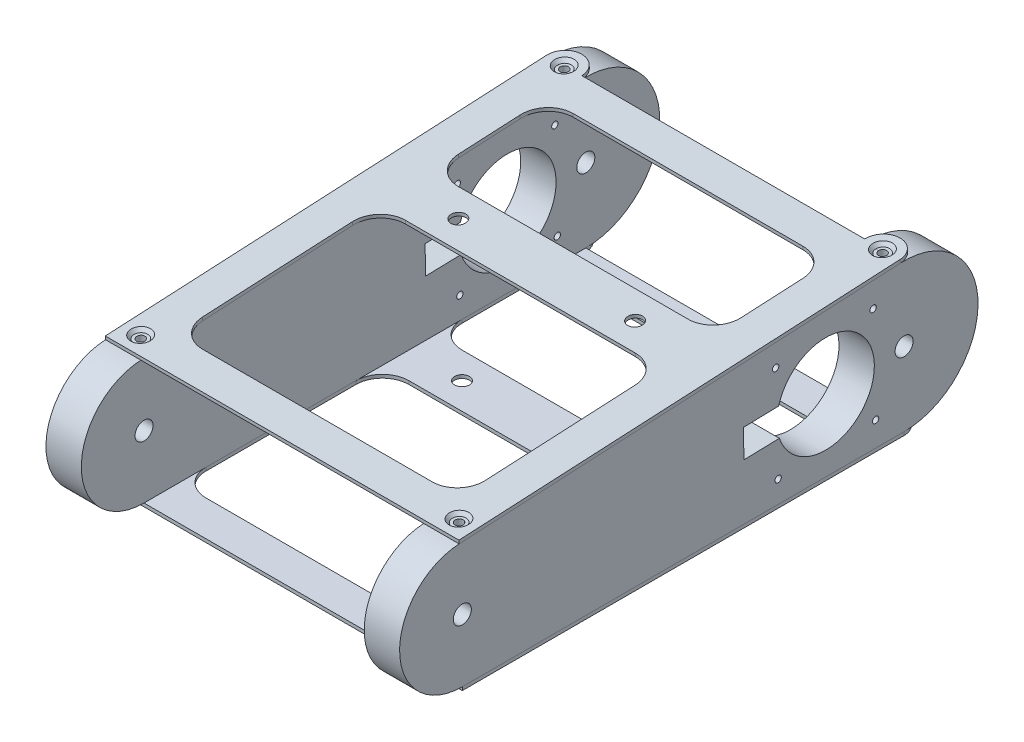
from build123d import *

# Parameters (mm, degrees)
SKETCH1_R                                     = 3.2385
BOSS_EXTRUDE1_DEPTH                           = 12.7
CUT_EXTRUDE1_DEPTH                            = 12.7
SKETCH5_R                                     = 1.143
CUT_EXTRUDE3_DEPTH                            = 12.7
BOSS_EXTRUDE2_DEPTH                           = 1.2
CSK_FOR_6_FLAT_HEAD_MACHINE_SCREW1_AT_2_COUNT = 2
CSK_FOR_6_FLAT_HEAD_MACHINE_SCREW1_AT_2_PITCH = 114.3
CSK_FOR_6_FLAT_HEAD_MACHINE_SCREW1_AT_3_COUNT = 2
CSK_FOR_6_FLAT_HEAD_MACHINE_SCREW1_AT_3_PITCH = 152.297013138
CSK_FOR_6_FLAT_HEAD_MACHINE_SCREW1_AT_4_COUNT = 2
CSK_FOR_6_FLAT_HEAD_MACHINE_SCREW1_AT_4_PITCH = 190.417620536
SKETCH9_R                                     = 2.667
SKETCH9_W                                     = 101.6
SKETCH9_H                                     = 41.275
SKETCH9_H_2                                   = 72.922013138
CUT_EXTRUDE4_DEPTH                            = 1.2
FILLET1_R                                     = 9.525
F_32_0_116_DIAMETER_HOLE1_AT_2_COUNT          = 2
F_32_0_116_DIAMETER_HOLE1_AT_2_PITCH          = 152.297013138
F_32_0_116_DIAMETER_HOLE1_AT_3_COUNT          = 2
F_32_0_116_DIAMETER_HOLE1_AT_3_PITCH          = 190.417620536
F_32_0_116_DIAMETER_HOLE1_AT_4_COUNT          = 2
F_32_0_116_DIAMETER_HOLE1_AT_4_PITCH          = 114.3


with BuildPart() as part:
    # Sketch1 → Boss-Extrude1 (new body)
    with BuildSketch(Plane(origin=(50.8, 0, 0), x_dir=(0, 0, -1), z_dir=(1, 0, 0))):
        with BuildLine():
            Line((-159.793954402, 18.448381084), (-1.35282588, 26.528205981))
            ThreePointArc((-1.35282588, 26.528205981), (26.554058426, 0.676632501), (0, -26.562677773))
            Line((0, -26.562677773), (-158.647013138, -26.562677773))
            ThreePointArc((-158.647013138, -26.562677773), (-181.159847775, -4.616192333), (-159.793954402, 18.448381084))
        make_face()
        with Locations((-158.647013138, -4.042535555)):
            Circle(SKETCH1_R, mode=Mode.SUBTRACT)
        Circle(SKETCH1_R, mode=Mode.SUBTRACT)
    extrude(amount=BOSS_EXTRUDE1_DEPTH)

    # Sketch2 → Cut-Extrude1 (cut)
    with BuildSketch(Plane(origin=(63.5, 0, 0), x_dir=(0, 0, -1), z_dir=(1, 0, 0))):
        with BuildLine():
            Line((-44.780052565, -6.224353351), (-57.480052565, -6.547966135))
            Line((-57.480052565, -6.547966135), (-57.738942792, 3.612033865))
            Line((-57.738942792, 3.612033865), (-45.038942792, 3.935646649))
            ThreePointArc((-45.038942792, 3.935646649), (-10.674659994, -0.272004444), (-44.780052565, -6.224353351))
        make_face()
    extrude(amount=-CUT_EXTRUDE1_DEPTH, mode=Mode.SUBTRACT)

    # Sketch5 → Cut-Extrude3 (cut)
    with BuildSketch(Plane(origin=(63.5, 0, 0), x_dir=(0, 0, -1), z_dir=(1, 0, 0))):
        with Locations((-46.109081348, 16.330760157)):
            Circle(SKETCH5_R)
        with Locations((-11.120438424, 17.222317018)):
            Circle(SKETCH5_R)
        with Locations((-10.228881564, -17.766325906)):
            Circle(SKETCH5_R)
        with Locations((-45.217524487, -18.657882766)):
            Circle(SKETCH5_R)
    extrude(amount=-CUT_EXTRUDE3_DEPTH, mode=Mode.SUBTRACT)


with BuildPart() as body_2:
    # Mirror2: mirrored copy
    add(part.part.mirror(Plane(origin=(0, 0, 0), x_dir=(0, 0, 1), z_dir=(1, 0, 0))))

    # Sketch12 → #32 (0.116) Diameter Hole1 (revolve, cut)
    with BuildSketch(Plane(origin=(-57.15, 26.528205981, 1.35282588), x_dir=(0, -0.05092957463974298, 0.9987022471322545), z_dir=(1, 0, 0))):
        Polygon((0, 0), (0, 13.585187864), (1.4732, 12.7), (1.4732, 0), align=None)
    f_32_0_116_diameter_hole1 = revolve(axis=Axis((-57.15, 32.869965251, 1.676228679), (0, -0.9987022471322546, -0.05092957463974298)), mode=Mode.SUBTRACT)

    # #32 (0.116) Diameter Hole1 at 2: #32 (0.116) Diameter Hole1 ×2
    with Locations(*[Vector(0, -0.050929574639742965, 0.9987022471322545) * (i * F_32_0_116_DIAMETER_HOLE1_AT_2_PITCH) for i in range(1, F_32_0_116_DIAMETER_HOLE1_AT_2_COUNT)]):
        add(f_32_0_116_diameter_hole1, mode=Mode.SUBTRACT)

    # Mirror4: #32 (0.116) Diameter Hole1 across plane
    add(f_32_0_116_diameter_hole1.mirror(Plane(origin=(0, 0, 0), x_dir=(0, -0.025473053092880782, 0.9996755091359031), z_dir=(0, 0.9996755091359032, 0.025473053092880785))), mode=Mode.SUBTRACT)

    # Mirror4 copy 1 sketch → Mirror4 copy 1 (revolve, cut)
    with BuildSketch(Plane(origin=(-57.15, -26.562677773, 152.297013138), x_dir=(0, 0, 1), z_dir=(1, 0, 0))):
        Polygon((0, 0), (0, -13.585187864), (1.4732, -12.7), (1.4732, 0), align=None)
    revolve(axis=Axis((-57.15, -32.912677773, 152.297013138), (0, -1, 0)), mode=Mode.SUBTRACT)


with BuildPart() as body_3:
    # Sketch6 → Boss-Extrude2 (new body)
    with BuildSketch(Plane(origin=(0, 26.528205981, 1.35282588), x_dir=(1, 0, 0), z_dir=(0, 0.9987022471322545, 0.05092957463974298))):
        with BuildLine():
            Line((-50.8, 0), (50.8, 0))
            ThreePointArc((50.8, 0), (57.15, 6.35), (63.5, 0))
            Line((63.5, 0), (63.5, -158.647013138))
            Line((63.5, -158.647013138), (-63.5, -158.647013138))
            Line((-63.5, -158.647013138), (-63.5, 0))
            ThreePointArc((-63.5, 0), (-57.15, 6.35), (-50.8, 0))
        make_face()
    extrude(amount=BOSS_EXTRUDE2_DEPTH)

    # Sketch8 → CSK for #6 Flat Head Machine Screw1 (revolve, cut)
    with BuildSketch(Plane(origin=(-57.15, 27.726648678, 1.41394137), x_dir=(0, -0.05092957463974298, 0.9987022471322545), z_dir=(1, 0, 0))):
        Polygon((0, 0), (0, 24.524177773), (2.15265, 24.524177773), (2.15265, 1.599759826), (3.5433, 0), align=None)
    csk_for_6_flat_head_machine_screw1 = revolve(axis=Axis((-57.15, 34.068407947, 1.737344169), (0, -0.9987022471322545, -0.05092957463974298)), mode=Mode.SUBTRACT)

    # CSK for #6 Flat Head Machine Screw1 at 2: CSK for #6 Flat Head Machine Screw1 ×2
    with Locations(*[(i * CSK_FOR_6_FLAT_HEAD_MACHINE_SCREW1_AT_2_PITCH, 0, 0) for i in range(1, CSK_FOR_6_FLAT_HEAD_MACHINE_SCREW1_AT_2_COUNT)]):
        add(csk_for_6_flat_head_machine_screw1, mode=Mode.SUBTRACT)

    # CSK for #6 Flat Head Machine Screw1 at 3: CSK for #6 Flat Head Machine Screw1 ×2
    with Locations(*[Vector(0, -0.05092957463974298, 0.9987022471322545) * (i * CSK_FOR_6_FLAT_HEAD_MACHINE_SCREW1_AT_3_PITCH) for i in range(1, CSK_FOR_6_FLAT_HEAD_MACHINE_SCREW1_AT_3_COUNT)]):
        add(csk_for_6_flat_head_machine_screw1, mode=Mode.SUBTRACT)

    # CSK for #6 Flat Head Machine Screw1 at 4: CSK for #6 Flat Head Machine Screw1 ×2
    with Locations(*[Vector(0.6002595751287851, -0.04073374132163811, 0.7987673032768382) * (i * CSK_FOR_6_FLAT_HEAD_MACHINE_SCREW1_AT_4_PITCH) for i in range(1, CSK_FOR_6_FLAT_HEAD_MACHINE_SCREW1_AT_4_COUNT)]):
        add(csk_for_6_flat_head_machine_screw1, mode=Mode.SUBTRACT)

    # Sketch9 → Cut-Extrude4 (cut)
    with BuildSketch(Plane(origin=(0, 27.726648678, 1.41394137), x_dir=(1, 0, 0), z_dir=(0, 0.9987022471322545, 0.05092957463974298))):
        with Locations(Location((-31.75, -63.5, 0), (0, 0, 270))):
            Circle(SKETCH9_R)
        with Locations(Location((31.75, -63.5, 0), (0, 0, 270))):
            Circle(SKETCH9_R)
        with Locations((0, -33.3375)):
            Rectangle(SKETCH9_W, SKETCH9_H)
        with Locations((0, -109.486006569)):
            Rectangle(SKETCH9_W, SKETCH9_H_2)
    extrude(amount=-CUT_EXTRUDE4_DEPTH, mode=Mode.SUBTRACT)

    # Fillet1
    fillet1_edges = [body_3.edges().sort_by_distance(p)[0] for p in [
        (50.8, 24.378503539, 55.288337414),
        (50.8, 26.480621732, 14.066902164),
        (-50.8, 26.480621732, 14.066902164),
        (-50.8, 24.378503539, 55.288337414),
        (50.8, 19.694408031, 147.140993608),
        (50.8, 23.408295142, 74.313615222),
        (-50.8, 23.408295142, 74.313615222),
        (-50.8, 19.694408031, 147.140993608),
    ]]
    fillet(fillet1_edges, radius=FILLET1_R)


with BuildPart() as body_4:
    # Mirror3: mirrored copy
    add(body_3.part.mirror(Plane(origin=(0, 0, 0), x_dir=(0, -0.025473053092880782, 0.9996755091359031), z_dir=(0, 0.9996755091359032, 0.025473053092880785))))


with BuildPart() as part_1:
    add(part.part)

    # #32 (0.116) Diameter Hole1 at 3: #32 (0.116) Diameter Hole1 ×2
    with Locations(*[Vector(0.6002595751287851, -0.040733741321638095, 0.7987673032768382) * (i * F_32_0_116_DIAMETER_HOLE1_AT_3_PITCH) for i in range(1, F_32_0_116_DIAMETER_HOLE1_AT_3_COUNT)]):
        add(f_32_0_116_diameter_hole1, mode=Mode.SUBTRACT)

    # #32 (0.116) Diameter Hole1 at 4: #32 (0.116) Diameter Hole1 ×2
    with Locations(*[(i * F_32_0_116_DIAMETER_HOLE1_AT_4_PITCH, 0, 0) for i in range(1, F_32_0_116_DIAMETER_HOLE1_AT_4_COUNT)]):
        add(f_32_0_116_diameter_hole1, mode=Mode.SUBTRACT)

    # Mirror4 copy 2 sketch → Mirror4 copy 2 (revolve, cut)
    with BuildSketch(Plane(origin=(57.15, -26.562677773, 152.297013138), x_dir=(0, 0, 1), z_dir=(1, 0, 0))):
        Polygon((0, 0), (0, -13.585187864), (1.4732, -12.7), (1.4732, 0), align=None)
    revolve(axis=Axis((57.15, -32.912677773, 152.297013138), (0, -1, 0)), mode=Mode.SUBTRACT)

    # Mirror4 copy 3 sketch → Mirror4 copy 3 (revolve, cut)
    with BuildSketch(Plane(origin=(57.15, -26.562677773, 0), x_dir=(0, 0, 1), z_dir=(1, 0, 0))):
        Polygon((0, 0), (0, -13.585187864), (1.4732, -12.7), (1.4732, 0), align=None)
    revolve(axis=Axis((57.15, -32.912677773, 0), (0, -1, 0)), mode=Mode.SUBTRACT)


solid = Compound([body_2.part, body_3.part, body_4.part, part_1.part])
